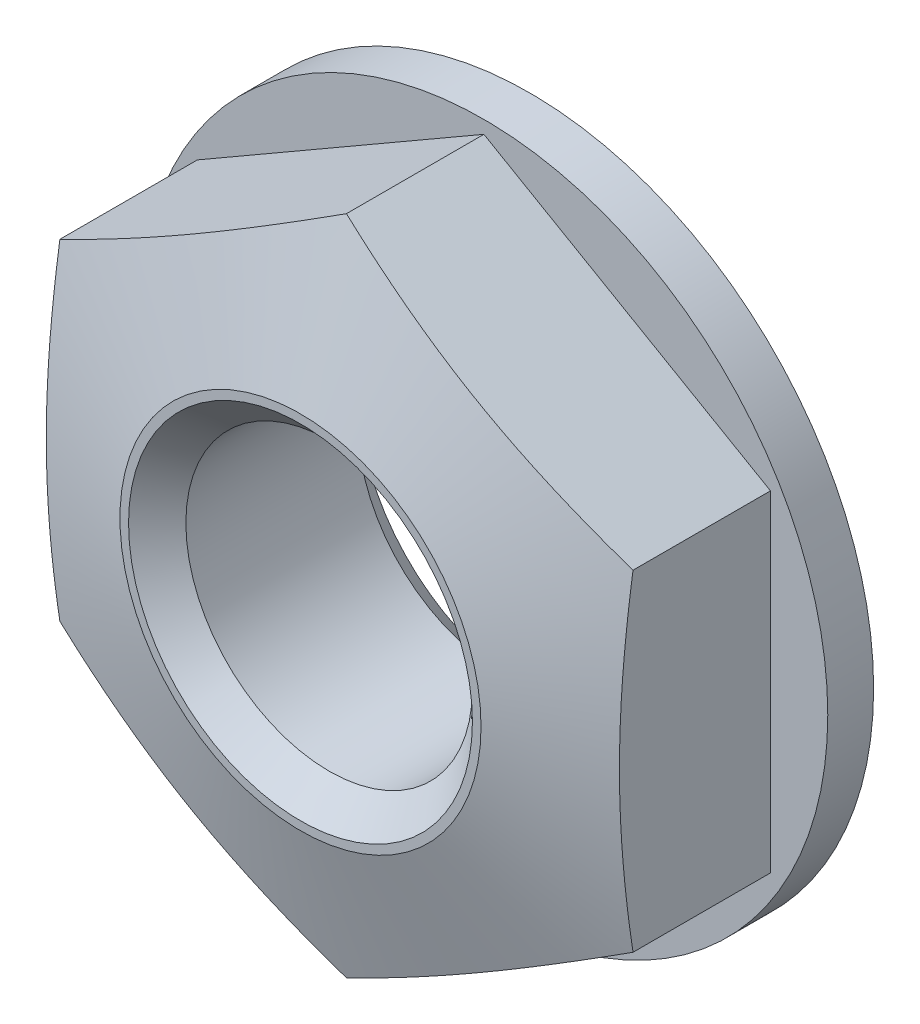
from build123d import *

# Parameters (mm, degrees)
SKETCH_1_R          = 6
EXTRUDE_1_DEPTH     = 0.8
EXTRUDE_2_DEPTH     = 3.2
SKETCH_3_OUTSIDE_W  = 38.42
SKETCH_3_OUTSIDE_H  = 38.42
SKETCH_3_OUTSIDE_R  = 3.15
CUT_EXTRUDE_1_DEPTH = 3.2
CUT_EXTRUDE_1_DRAFT = -73
HOLE_WIZARD_M61_D   = 5
CHAMFER_1_SIZE      = 0.5
CHAMFER_2_SIZE      = 0.5


with BuildPart() as part:
    # Эскиз1 → Бобышка-Вытянуть1 (new body)
    with BuildSketch(Plane.XY):
        Circle(SKETCH_1_R)
    extrude(amount=EXTRUDE_1_DEPTH)

    # Эскиз2 → Бобышка-Вытянуть2 (add)
    with BuildSketch(Plane.XY.offset(0.8)):
        Polygon((0, 5.773502692), (-5, 2.886751346), (-5, -2.886751346), (0, -5.773502692), (5, -2.886751346), (5, 2.886751346), align=None)
    extrude(amount=EXTRUDE_2_DEPTH)


with BuildPart() as cut_extrude_1_tool:
    # Эскиз3 outside → Вырез-Вытянуть1 (with draft: the straight prism first)
    with BuildSketch(Plane.XY.offset(4)):
        Rectangle(SKETCH_3_OUTSIDE_W, SKETCH_3_OUTSIDE_H)
        Circle(SKETCH_3_OUTSIDE_R, mode=Mode.SUBTRACT)
    extrude(amount=-CUT_EXTRUDE_1_DEPTH)
    # Вырез-Вытянуть1: the draft: its side faces are tilted about the plane it starts from
    cut_extrude_1_sides = [cut_extrude_1_tool.faces().sort_by_distance(p)[0] for p in [
        (0, -19.21, 2.4),
        (19.21, 0, 2.4),
        (0, 19.21, 2.4),
        (-19.21, 0, 2.4),
        (-3.15, 0, 2.4),
    ]]
    draft(cut_extrude_1_sides, Plane.XY.offset(4), CUT_EXTRUDE_1_DRAFT)


with BuildPart() as part_1:
    add(part.part)

    # Вырез-Вытянуть1: cut by cut_extrude_1_tool
    add(cut_extrude_1_tool.part, mode=Mode.SUBTRACT)

    # Отверстие обработанное метчиком M61 (through all)
    with Locations(Plane.XY.offset(4)):
        with Locations((0, 0)):
            Hole(HOLE_WIZARD_M61_D / 2)

    # Фаска1
    chamfer_1_edges = [part_1.edges().sort_by_distance(p)[0] for p in [
        (2.5, 0, 4),
    ]]
    chamfer(chamfer_1_edges, length=CHAMFER_1_SIZE)

    # Фаска2
    chamfer_2_edges = [part_1.edges().sort_by_distance(p)[0] for p in [
        (2.5, 0, 0),
    ]]
    chamfer(chamfer_2_edges, length=CHAMFER_2_SIZE)


solid = part_1.part
